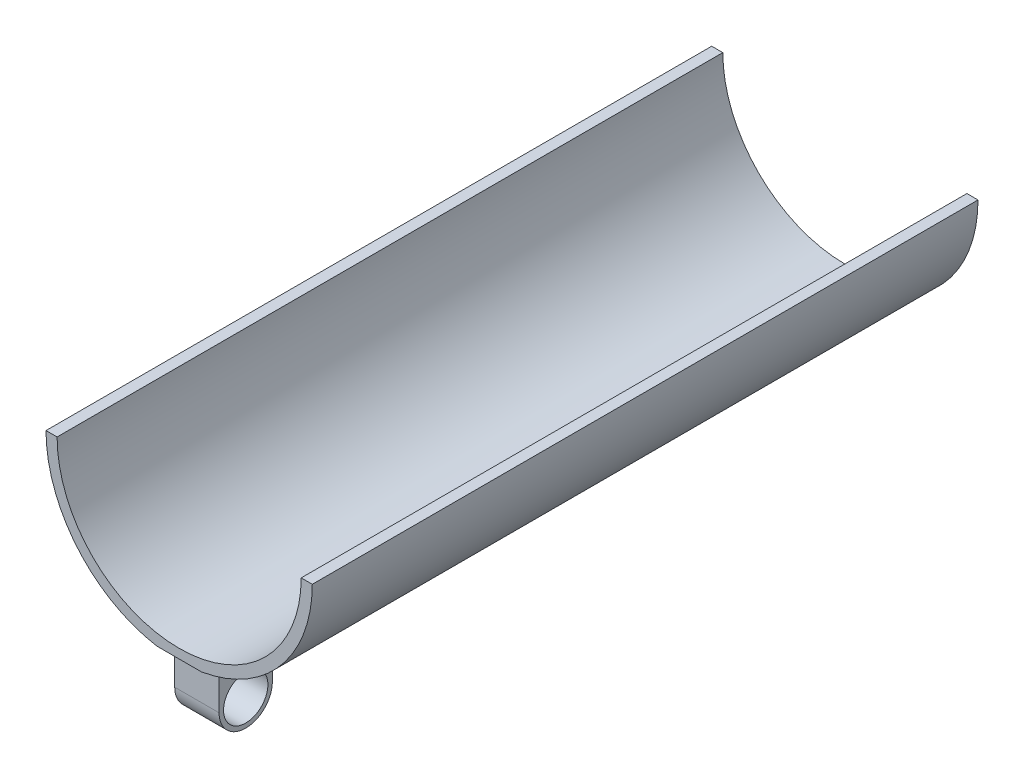
from build123d import *

# Parameters (mm, degrees)
BOSS_EXTRUDE1_DEPTH = 150
BOSS_EXTRUDE2_START = -20
BOSS_EXTRUDE2_DEPTH = 20
SKETCH3_R           = 5
CUT_EXTRUDE1_DEPTH  = 20
CUT_EXTRUDE2_DEPTH  = 10


with BuildPart() as part:
    # Sketch1 → Boss-Extrude1 (new body)
    with BuildSketch(Plane.XY):
        with BuildLine():
            Line((30, 0), (27.5, 0))
            ThreePointArc((27.5, 0), (0, -27.5), (-27.5, 0))
            Line((-27.5, 0), (-30, 0))
            ThreePointArc((-30, 0), (0, -30), (30, 0))
        make_face()
    extrude(amount=BOSS_EXTRUDE1_DEPTH)

    # Sketch2 → Boss-Extrude2 (add)
    with BuildSketch(Plane.XY.offset(150).offset(BOSS_EXTRUDE2_START)):
        with BuildLine():
            Line((0, -45.496190277), (0, -30))
            ThreePointArc((0, -30), (-2.508787808, -29.894915684), (-5, -29.580398915))
            Line((-5, -29.580398915), (-5, -48))
            Line((-5, -48), (0, -48))
            Line((0, -48), (0, -45.496190277))
        make_face()
        with BuildLine():
            ThreePointArc((5, -29.580398915), (2.508787808, -29.894915684), (0, -30))
            Line((0, -30), (0, -45.496190277))
            Line((0, -45.496190277), (0, -48))
            Line((0, -48), (5, -48))
            Line((5, -48), (5, -29.580398915))
        make_face()
    extrude(amount=BOSS_EXTRUDE2_DEPTH)

    # Sketch3 → Cut-Extrude1 (cut)
    with BuildSketch(Plane(origin=(5, 0, 0), x_dir=(0, 0, -1), z_dir=(1, 0, 0))):
        with Locations(Location((-140, -39.580398915, 0), (0, 0, 90))):
            Circle(SKETCH3_R)
    extrude(amount=-CUT_EXTRUDE1_DEPTH, mode=Mode.SUBTRACT)

    # Sketch4 → Cut-Extrude2 (cut)
    with BuildSketch(Plane(origin=(5, 0, 0), x_dir=(0, 0, -1), z_dir=(1, 0, 0))):
        with BuildLine():
            ThreePointArc((-134, -39.580398915), (-140, -45.580398915), (-146, -39.580398915))
            Line((-146, -39.580398915), (-146, -29.580398915))
            Line((-146, -29.580398915), (-150, -29.580398915))
            Line((-150, -29.580398915), (-150, -48))
            Line((-150, -48), (-130, -48))
            Line((-130, -48), (-130, -29.580398915))
            Line((-130, -29.580398915), (-134, -29.580398915))
            Line((-134, -29.580398915), (-134, -39.580398915))
        make_face()
    extrude(amount=-CUT_EXTRUDE2_DEPTH, mode=Mode.SUBTRACT)


solid = part.part
